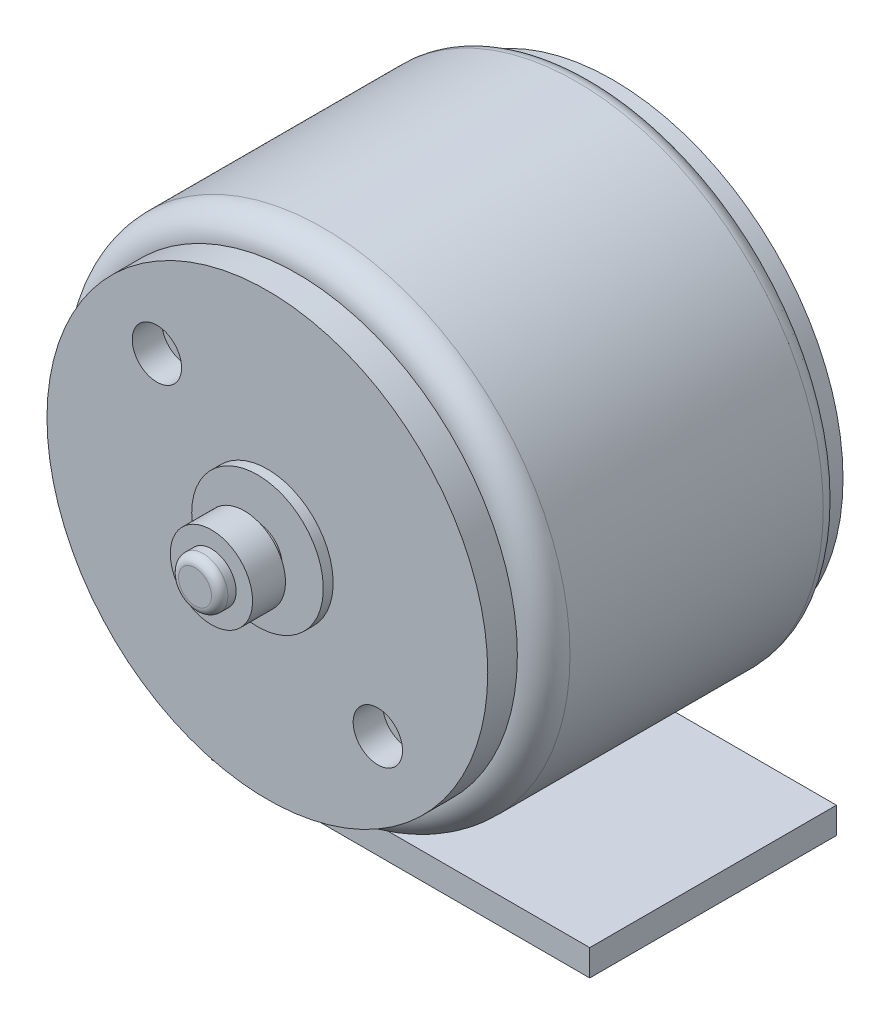
from build123d import *

# Parameters (mm, degrees)
SKETCH_4_W                = 11.5
SKETCH_4_H                = 7.5
EXTRUDE_1960_DEPTH        = 0.8
SKETCH_2004_R             = 0.75
EXTRUDE_3_DEPTH           = 0.7
EXTRUDE_3_DRAFT           = 35
EXTRUDE_3_PROFILE_2_DEPTH = 0.7
EXTRUDE_3_PROFILE_2_DRAFT = 35
EXTRUDE_3_PROFILE_3_DEPTH = 0.7
EXTRUDE_3_PROFILE_3_DRAFT = 35
EXTRUDE_3_PROFILE_4_DEPTH = 0.7
EXTRUDE_3_PROFILE_4_DRAFT = 35
EXTRUDE_3_PROFILE_5_DEPTH = 0.7
EXTRUDE_3_PROFILE_5_DRAFT = 35
EXTRUDE_3_PROFILE_6_DEPTH = 0.7
EXTRUDE_3_PROFILE_6_DRAFT = 35
EXTRUDE_3_PROFILE_7_DEPTH = 0.7
EXTRUDE_3_PROFILE_7_DRAFT = 35
EXTRUDE_3_PROFILE_8_DEPTH = 0.7
EXTRUDE_3_PROFILE_8_DRAFT = 35
EXTRUDE_4_DEPTH           = 0.01
SKETCH_7_R                = 0.75
CUT_EXTRUDE_1_DEPTH       = 0.9


with BuildPart() as part:
    # Эскиз1 → Motor (revolve)
    with BuildSketch(Plane(origin=(0, 0, 0), x_dir=(1, 0, 0), z_dir=(0, 1, 0))):
        with BuildLine():
            Line((0, 0), (-0.5, 0))
            ThreePointArc((-0.5, 0), (-0.676776695, -0.073223305), (-0.75, -0.25))
            Line((-0.75, -0.25), (-0.75, -0.5))
            Line((-0.75, -0.5), (-3, -0.5))
            Line((-3, -0.5), (-3, -1.5))
            Line((-3, -1.5), (-7, -1.5))
            Line((-7, -1.5), (-7, -2.1))
            ThreePointArc((-7, -2.1), (-7.353553391, -2.246446609), (-7.5, -2.6))
            Line((-7.5, -2.6), (-7.5, -10.3))
            ThreePointArc((-7.5, -10.3), (-7.265685425, -10.865685425), (-6.7, -11.1))
            Line((-6.7, -11.1), (-6.7, -12))
            Line((-6.7, -12), (-2, -12))
            Line((-2, -12), (-2, -12.3))
            Line((-2, -12.3), (-0.75, -12.3))
            Line((-0.75, -12.3), (-0.75, -12.7))
            Line((-0.75, -12.7), (-1.25, -12.7))
            Line((-1.25, -12.7), (-1.25, -13.7))
            Line((-1.25, -13.7), (-0.75, -13.7))
            Line((-0.75, -13.7), (-0.75, -13.95))
            ThreePointArc((-0.75, -13.95), (-0.676776695, -14.126776695), (-0.5, -14.2))
            Line((-0.5, -14.2), (0, -14.2))
            Line((0, -14.2), (0, -12))
            Line((0, -12), (0, 0))
        make_face()
    revolve(axis=Axis((0, 0, 0), (0, 0, 1)))

    # Эскиз7 → Вырез-Вытянуть1 (cut)
    with BuildSketch(Plane.XY.offset(12)):
        with Locations((3.358757211, -3.358757211)):
            Circle(SKETCH_7_R)
        with Locations((-3.358757211, 3.358757211)):
            Circle(SKETCH_7_R)
    extrude(amount=-CUT_EXTRUDE_1_DEPTH, mode=Mode.SUBTRACT)


with BuildPart() as body_2:
    # Эскиз4 → Extrude 1960 (new body)
    with BuildSketch(Plane(origin=(0, -7.5, 0), x_dir=(-1, 0, 0), z_dir=(0, -1, 0))):
        with Locations((-2.25, -6.45)):
            Rectangle(SKETCH_4_W, SKETCH_4_H)
    extrude(amount=EXTRUDE_1960_DEPTH)


with BuildPart() as extrude_3_tool:
    # Sketch 2004 → Бобышка-Вытянуть3 (with draft: the straight prism first)
    with BuildSketch(Plane.XZ.offset(8.3)):
        with Locations((-2.25, 5.7)):
            Circle(SKETCH_2004_R)
    extrude(amount=EXTRUDE_3_DEPTH)
    # Бобышка-Вытянуть3: the draft: its side faces are tilted about the plane it starts from
    extrude_3_sides = [extrude_3_tool.faces().sort_by_distance(p)[0] for p in [
        (-3, -8.65, 5.7),
    ]]
    draft(extrude_3_sides, Plane.XZ.offset(8.3), EXTRUDE_3_DRAFT)


with BuildPart() as body_2_1:
    add(body_2.part)

    # Бобышка-Вытянуть3: add extrude_3_tool
    add(extrude_3_tool.part)


with BuildPart() as extrude_3_profile_2_tool:
    # Sketch 2004 → Бобышка-Вытянуть3 profile 2 (with draft: the straight prism first)
    with BuildSketch(Plane.XZ.offset(8.3)):
        with Locations((-0.75, 7.2)):
            Circle(SKETCH_2004_R)
    extrude(amount=EXTRUDE_3_PROFILE_2_DEPTH)
    # Бобышка-Вытянуть3 profile 2: the draft: its side faces are tilted about the plane it starts from
    extrude_3_profile_2_sides = [extrude_3_profile_2_tool.faces().sort_by_distance(p)[0] for p in [
        (-1.5, -8.65, 7.2),
    ]]
    draft(extrude_3_profile_2_sides, Plane.XZ.offset(8.3), EXTRUDE_3_PROFILE_2_DRAFT)


with BuildPart() as body_2_2:
    add(body_2_1.part)

    # Бобышка-Вытянуть3 profile 2: add extrude_3_profile_2_tool
    add(extrude_3_profile_2_tool.part)


with BuildPart() as extrude_3_profile_3_tool:
    # Sketch 2004 → Бобышка-Вытянуть3 profile 3 (with draft: the straight prism first)
    with BuildSketch(Plane.XZ.offset(8.3)):
        with Locations((0.75, 5.7)):
            Circle(SKETCH_2004_R)
    extrude(amount=EXTRUDE_3_PROFILE_3_DEPTH)
    # Бобышка-Вытянуть3 profile 3: the draft: its side faces are tilted about the plane it starts from
    extrude_3_profile_3_sides = [extrude_3_profile_3_tool.faces().sort_by_distance(p)[0] for p in [
        (0, -8.65, 5.7),
    ]]
    draft(extrude_3_profile_3_sides, Plane.XZ.offset(8.3), EXTRUDE_3_PROFILE_3_DRAFT)


with BuildPart() as body_2_3:
    add(body_2_2.part)

    # Бобышка-Вытянуть3 profile 3: add extrude_3_profile_3_tool
    add(extrude_3_profile_3_tool.part)


with BuildPart() as extrude_3_profile_4_tool:
    # Sketch 2004 → Бобышка-Вытянуть3 profile 4 (with draft: the straight prism first)
    with BuildSketch(Plane.XZ.offset(8.3)):
        with Locations((2.25, 7.2)):
            Circle(SKETCH_2004_R)
    extrude(amount=EXTRUDE_3_PROFILE_4_DEPTH)
    # Бобышка-Вытянуть3 profile 4: the draft: its side faces are tilted about the plane it starts from
    extrude_3_profile_4_sides = [extrude_3_profile_4_tool.faces().sort_by_distance(p)[0] for p in [
        (1.5, -8.65, 7.2),
    ]]
    draft(extrude_3_profile_4_sides, Plane.XZ.offset(8.3), EXTRUDE_3_PROFILE_4_DRAFT)


with BuildPart() as body_2_4:
    add(body_2_3.part)

    # Бобышка-Вытянуть3 profile 4: add extrude_3_profile_4_tool
    add(extrude_3_profile_4_tool.part)


with BuildPart() as extrude_3_profile_5_tool:
    # Sketch 2004 → Бобышка-Вытянуть3 profile 5 (with draft: the straight prism first)
    with BuildSketch(Plane.XZ.offset(8.3)):
        with Locations((7, 3.7)):
            Circle(SKETCH_2004_R)
    extrude(amount=EXTRUDE_3_PROFILE_5_DEPTH)
    # Бобышка-Вытянуть3 profile 5: the draft: its side faces are tilted about the plane it starts from
    extrude_3_profile_5_sides = [extrude_3_profile_5_tool.faces().sort_by_distance(p)[0] for p in [
        (6.25, -8.65, 3.7),
    ]]
    draft(extrude_3_profile_5_sides, Plane.XZ.offset(8.3), EXTRUDE_3_PROFILE_5_DRAFT)


with BuildPart() as body_2_5:
    add(body_2_4.part)

    # Бобышка-Вытянуть3 profile 5: add extrude_3_profile_5_tool
    add(extrude_3_profile_5_tool.part)


with BuildPart() as extrude_3_profile_6_tool:
    # Sketch 2004 → Бобышка-Вытянуть3 profile 6 (with draft: the straight prism first)
    with BuildSketch(Plane.XZ.offset(8.3)):
        with Locations((7, 5.533333333)):
            Circle(SKETCH_2004_R)
    extrude(amount=EXTRUDE_3_PROFILE_6_DEPTH)
    # Бобышка-Вытянуть3 profile 6: the draft: its side faces are tilted about the plane it starts from
    extrude_3_profile_6_sides = [extrude_3_profile_6_tool.faces().sort_by_distance(p)[0] for p in [
        (6.25, -8.65, 5.533333333),
    ]]
    draft(extrude_3_profile_6_sides, Plane.XZ.offset(8.3), EXTRUDE_3_PROFILE_6_DRAFT)


with BuildPart() as body_2_6:
    add(body_2_5.part)

    # Бобышка-Вытянуть3 profile 6: add extrude_3_profile_6_tool
    add(extrude_3_profile_6_tool.part)


with BuildPart() as extrude_3_profile_7_tool:
    # Sketch 2004 → Бобышка-Вытянуть3 profile 7 (with draft: the straight prism first)
    with BuildSketch(Plane.XZ.offset(8.3)):
        with Locations((7, 7.366666667)):
            Circle(SKETCH_2004_R)
    extrude(amount=EXTRUDE_3_PROFILE_7_DEPTH)
    # Бобышка-Вытянуть3 profile 7: the draft: its side faces are tilted about the plane it starts from
    extrude_3_profile_7_sides = [extrude_3_profile_7_tool.faces().sort_by_distance(p)[0] for p in [
        (6.25, -8.65, 7.366666667),
    ]]
    draft(extrude_3_profile_7_sides, Plane.XZ.offset(8.3), EXTRUDE_3_PROFILE_7_DRAFT)


with BuildPart() as body_2_7:
    add(body_2_6.part)

    # Бобышка-Вытянуть3 profile 7: add extrude_3_profile_7_tool
    add(extrude_3_profile_7_tool.part)


with BuildPart() as extrude_3_profile_8_tool:
    # Sketch 2004 → Бобышка-Вытянуть3 profile 8 (with draft: the straight prism first)
    with BuildSketch(Plane.XZ.offset(8.3)):
        with Locations((7, 9.2)):
            Circle(SKETCH_2004_R)
    extrude(amount=EXTRUDE_3_PROFILE_8_DEPTH)
    # Бобышка-Вытянуть3 profile 8: the draft: its side faces are tilted about the plane it starts from
    extrude_3_profile_8_sides = [extrude_3_profile_8_tool.faces().sort_by_distance(p)[0] for p in [
        (6.25, -8.65, 9.2),
    ]]
    draft(extrude_3_profile_8_sides, Plane.XZ.offset(8.3), EXTRUDE_3_PROFILE_8_DRAFT)


with BuildPart() as body_2_8:
    add(body_2_7.part)

    # Бобышка-Вытянуть3 profile 8: add extrude_3_profile_8_tool
    add(extrude_3_profile_8_tool.part)

    # Эскиз6 → Бобышка-Вытянуть4 (add)
    # profile 1 of 16: a face of its own
    with BuildSketch(Plane.XZ.offset(8.3)):
        with BuildLine():
            Line((5.183226347, 9.305128205), (5.183226347, 9.228846154))
            add(Edge.make_bspline(
                [(5.183226347, 9.228846154), (5.173106274, 9.22934332), (5.153230721, 9.23031974), (5.124252058, 9.234892324), (5.096553035, 9.241435109), (5.070356056, 9.250685891), (5.045429488, 9.262174558), (5.021872342, 9.27595185), (4.999774482, 9.292270357), (4.979340763, 9.310777707), (4.96059521, 9.330878662), (4.944407508, 9.352567247), (4.930730359, 9.375358182), (4.919296343, 9.399182322), (4.910713809, 9.424308459), (4.904345697, 9.450508582), (4.900514298, 9.4778978), (4.900102465, 9.496558949), (4.899893013, 9.506049679)],
                knots=[0, 0, 0, 0, 1.10065271, 2.161652631, 3.183658789, 4.190468796, 5.17591951, 6.163126047, 7.15150782, 8.156236427, 9.156009102, 10.134482811, 11.092018607, 12.041330605, 13.001268258, 13.972401359, 14.968799086, 16, 16, 16, 16], degree=3))
            add(Edge.make_bspline(
                [(4.899893013, 9.506049679), (4.900109439, 9.515370725), (4.900534708, 9.533686246), (4.904241722, 9.560406313), (4.909922389, 9.585903666), (4.918340243, 9.609889343), (4.928902809, 9.632609504), (4.942038744, 9.653782836), (4.957126498, 9.673921332), (4.974923245, 9.69203663), (4.993912419, 9.708677717), (5.014192696, 9.723021328), (5.035163128, 9.735374158), (5.056987523, 9.745484564), (5.079736952, 9.753148701), (5.10319331, 9.758827092), (5.127627297, 9.762073168), (5.144167936, 9.762568621), (5.152577308, 9.762820513)],
                knots=[0, 0, 0, 0, 1.111674182, 2.184400057, 3.212814286, 4.223731311, 5.211378316, 6.196328225, 7.191884489, 8.207283132, 9.220262353, 10.201199469, 11.166417575, 12.120932471, 13.06540007, 14.026332106, 14.996573967, 16, 16, 16, 16], degree=3))
            add(Edge.make_bspline(
                [(5.152577308, 9.762820513), (5.164416063, 9.762409285), (5.187885819, 9.761594047), (5.222375218, 9.75462065), (5.255790478, 9.743728994), (5.282684739, 9.730616512), (5.304353679, 9.717384889), (5.322203622, 9.705473201), (5.341418154, 9.691449296), (5.362075046, 9.675432988), (5.383903778, 9.657148454), (5.407349714, 9.637070722), (5.431979324, 9.614681279), (5.448812639, 9.598980897), (5.457535241, 9.590845353)],
                knots=[0, 0, 0, 0, 1.184416499, 2.348048165, 3.509039915, 4.696071444, 5.333504901, 6.05069495, 6.844171097, 7.714965912, 8.667477798, 9.695072654, 10.805644396, 12, 12, 12, 12], degree=3))
            Line((5.457535241, 9.590845353), (5.684508398, 9.37817508))
            Line((5.684508398, 9.37817508), (5.684508398, 9.773717949))
            Line((5.684508398, 9.773717949), (5.771687885, 9.773717949))
            Line((5.771687885, 9.773717949), (5.771687885, 9.196153846))
            Line((5.771687885, 9.196153846), (5.419905033, 9.525801282))
            add(Edge.make_bspline(
                [(5.419905033, 9.525801282), (5.411526873, 9.533827197), (5.395434141, 9.549243338), (5.371939423, 9.571047678), (5.350143106, 9.590631433), (5.330086372, 9.608121371), (5.311475849, 9.623138079), (5.294914278, 9.636464193), (5.279673911, 9.647141551), (5.262008334, 9.658729575), (5.240439628, 9.669952971), (5.214081446, 9.6795974), (5.186947685, 9.685478149), (5.168611476, 9.686183609), (5.159388206, 9.686538462)],
                knots=[0, 0, 0, 0, 1.329631726, 2.553950428, 3.673215718, 4.687767853, 5.603093632, 6.413772471, 7.123043292, 7.734684054, 8.834405432, 9.900288307, 10.943827018, 12, 12, 12, 12], degree=3))
            add(Edge.make_bspline(
                [(5.159388206, 9.686538462), (5.153588438, 9.686384067), (5.142158208, 9.686079785), (5.125399667, 9.683394344), (5.109233926, 9.679336078), (5.093611262, 9.673520801), (5.078688746, 9.665844879), (5.064448215, 9.656501344), (5.050680895, 9.6457209), (5.037772237, 9.633249877), (5.025949658, 9.619549937), (5.015476666, 9.605077047), (5.006724311, 9.589764879), (4.999549462, 9.573677992), (4.993921155, 9.556861236), (4.990021214, 9.539282083), (4.987572611, 9.520989108), (4.987241312, 9.508498116), (4.987072501, 9.502133413)],
                knots=[0, 0, 0, 0, 0.991446411, 1.95395049, 2.89581595, 3.838931463, 4.798493298, 5.75982156, 6.748411868, 7.785213223, 8.824556874, 9.840280684, 10.836137867, 11.835679398, 12.848801643, 13.863922112, 14.911575587, 16, 16, 16, 16], degree=3))
            add(Edge.make_bspline(
                [(4.987072501, 9.502133413), (4.987239299, 9.495484543), (4.987566864, 9.482427259), (4.990048006, 9.463296967), (4.993809418, 9.444921487), (4.999783361, 9.427574998), (5.006841872, 9.410881872), (5.015808949, 9.395198482), (5.026228891, 9.380264435), (5.03831124, 9.366325367), (5.051886632, 9.353594562), (5.066847651, 9.342251598), (5.08308659, 9.332405907), (5.1005368, 9.323803635), (5.119372022, 9.316820921), (5.139521114, 9.311484355), (5.160897794, 9.307261899), (5.175659878, 9.305851249), (5.183226347, 9.305128205)],
                knots=[0, 0, 0, 0, 1.030878251, 2.024474673, 2.987898669, 3.934362936, 4.864849709, 5.795128259, 6.730474222, 7.685293701, 8.650606017, 9.611896181, 10.591709709, 11.591680886, 12.625074257, 13.701333388, 14.821793024, 16, 16, 16, 16], degree=3))
        make_face()
    # profile 2 of 16: a face of its own
    with BuildSketch(Plane.XZ.offset(8.3)):
        Polygon((4.921687885, 8.749358974), (5.771687885, 9.141666667), (5.771687885, 9.05874399), (5.499251988, 8.933082933), (5.499251988, 8.54775641), (5.771687885, 8.418519631), (5.771687885, 8.33525641), (4.921687885, 8.738461538), align=None)
        Polygon((5.087362965, 8.743058894), (5.412072501, 8.589132612), (5.412072501, 8.892898638), align=None, mode=Mode.SUBTRACT)
    # profile 3 of 16: a face of its own
    with BuildSketch(Plane.XZ.offset(8.3)):
        Polygon((4.921687885, 7.524248798), (4.921687885, 7.681410256), (5.771687885, 7.681410256), (5.771687885, 7.605128205), (5.008867372, 7.605128205), (5.008867372, 7.474358974), align=None)
    # profile 4 of 16: a face of its own
    with BuildSketch(Plane.XZ.offset(8.3)):
        Polygon((4.921687885, 6.896794872), (5.771687885, 7.289102564), (5.771687885, 7.206179888), (5.499251988, 7.08051883), (5.499251988, 6.695192308), (5.771687885, 6.565955529), (5.771687885, 6.482692308), (4.921687885, 6.885897436), align=None)
        Polygon((5.087362965, 6.890494792), (5.412072501, 6.73656851), (5.412072501, 7.040334535), align=None, mode=Mode.SUBTRACT)
    # profile 5 of 16: a face of its own
    with BuildSketch(Plane.XZ.offset(8.3)):
        with BuildLine():
            Line((5.183226347, 5.6), (5.183226347, 5.523717949))
            add(Edge.make_bspline(
                [(5.183226347, 5.523717949), (5.173106274, 5.524215114), (5.153230721, 5.525191535), (5.124252058, 5.529764119), (5.096553035, 5.536306904), (5.070356056, 5.545557685), (5.045429488, 5.557046353), (5.021872342, 5.570823645), (4.999774482, 5.587142152), (4.979340763, 5.605649501), (4.96059521, 5.625750457), (4.944407508, 5.647439042), (4.930730359, 5.670229977), (4.919296343, 5.694054117), (4.910713809, 5.719180254), (4.904345697, 5.745380376), (4.900514298, 5.772769595), (4.900102465, 5.791430743), (4.899893013, 5.800921474)],
                knots=[0, 0, 0, 0, 1.10065271, 2.161652631, 3.183658789, 4.190468796, 5.17591951, 6.163126047, 7.15150782, 8.156236427, 9.156009102, 10.134482811, 11.092018607, 12.041330605, 13.001268258, 13.972401359, 14.968799086, 16, 16, 16, 16], degree=3))
            add(Edge.make_bspline(
                [(4.899893013, 5.800921474), (4.900109439, 5.81024252), (4.900534708, 5.828558041), (4.904241722, 5.855278108), (4.909922389, 5.880775461), (4.918340243, 5.904761137), (4.928902809, 5.927481298), (4.942038744, 5.94865463), (4.957126498, 5.968793127), (4.974923245, 5.986908425), (4.993912419, 6.003549512), (5.014192696, 6.017893123), (5.035163128, 6.030245953), (5.056987523, 6.040356359), (5.079736952, 6.048020496), (5.10319331, 6.053698887), (5.127627297, 6.056944963), (5.144167936, 6.057440416), (5.152577308, 6.057692308)],
                knots=[0, 0, 0, 0, 1.111674182, 2.184400057, 3.212814286, 4.223731311, 5.211378316, 6.196328225, 7.191884489, 8.207283132, 9.220262353, 10.201199469, 11.166417575, 12.120932471, 13.06540007, 14.026332106, 14.996573967, 16, 16, 16, 16], degree=3))
            add(Edge.make_bspline(
                [(5.152577308, 6.057692308), (5.164416063, 6.05728108), (5.187885819, 6.056465842), (5.222375218, 6.049492445), (5.255790478, 6.038600789), (5.282684739, 6.025488307), (5.304353679, 6.012256684), (5.322203622, 6.000344996), (5.341418154, 5.986321091), (5.362075046, 5.970304783), (5.383903778, 5.952020248), (5.407349714, 5.931942517), (5.431979324, 5.909553074), (5.448812639, 5.893852692), (5.457535241, 5.885717147)],
                knots=[0, 0, 0, 0, 1.184416499, 2.348048165, 3.509039915, 4.696071444, 5.333504901, 6.05069495, 6.844171097, 7.714965912, 8.667477798, 9.695072654, 10.805644396, 12, 12, 12, 12], degree=3))
            Line((5.457535241, 5.885717147), (5.684508398, 5.673046875))
            Line((5.684508398, 5.673046875), (5.684508398, 6.068589744))
            Line((5.684508398, 6.068589744), (5.771687885, 6.068589744))
            Line((5.771687885, 6.068589744), (5.771687885, 5.491025641))
            Line((5.771687885, 5.491025641), (5.419905033, 5.820673077))
            add(Edge.make_bspline(
                [(5.419905033, 5.820673077), (5.411526873, 5.828698992), (5.395434141, 5.844115133), (5.371939423, 5.865919473), (5.350143106, 5.885503228), (5.330086372, 5.902993166), (5.311475849, 5.918009874), (5.294914278, 5.931335988), (5.279673911, 5.942013346), (5.262008334, 5.95360137), (5.240439628, 5.964824766), (5.214081446, 5.974469195), (5.186947685, 5.980349944), (5.168611476, 5.981055404), (5.159388206, 5.981410256)],
                knots=[0, 0, 0, 0, 1.329631726, 2.553950428, 3.673215718, 4.687767853, 5.603093632, 6.413772471, 7.123043292, 7.734684054, 8.834405432, 9.900288307, 10.943827018, 12, 12, 12, 12], degree=3))
            add(Edge.make_bspline(
                [(5.159388206, 5.981410256), (5.153588438, 5.981255862), (5.142158208, 5.98095158), (5.125399667, 5.978266139), (5.109233926, 5.974207873), (5.093611262, 5.968392596), (5.078688746, 5.960716674), (5.064448215, 5.951373139), (5.050680895, 5.940592695), (5.037772237, 5.928121672), (5.025949658, 5.914421732), (5.015476666, 5.899948842), (5.006724311, 5.884636674), (4.999549462, 5.868549787), (4.993921155, 5.85173303), (4.990021214, 5.834153878), (4.987572611, 5.815860903), (4.987241312, 5.803369911), (4.987072501, 5.797005208)],
                knots=[0, 0, 0, 0, 0.991446411, 1.95395049, 2.89581595, 3.838931463, 4.798493298, 5.75982156, 6.748411868, 7.785213223, 8.824556874, 9.840280684, 10.836137867, 11.835679398, 12.848801643, 13.863922112, 14.911575587, 16, 16, 16, 16], degree=3))
            add(Edge.make_bspline(
                [(4.987072501, 5.797005208), (4.987239299, 5.790356338), (4.987566864, 5.777299054), (4.990048006, 5.758168762), (4.993809418, 5.739793282), (4.999783361, 5.722446793), (5.006841872, 5.705753667), (5.015808949, 5.690070277), (5.026228891, 5.67513623), (5.03831124, 5.661197162), (5.051886632, 5.648466356), (5.066847651, 5.637123393), (5.08308659, 5.627277702), (5.1005368, 5.61867543), (5.119372022, 5.611692716), (5.139521114, 5.606356149), (5.160897794, 5.602133694), (5.175659878, 5.600723044), (5.183226347, 5.6)],
                knots=[0, 0, 0, 0, 1.030878251, 2.024474673, 2.987898669, 3.934362936, 4.864849709, 5.795128259, 6.730474222, 7.685293701, 8.650606017, 9.611896181, 10.591709709, 11.591680886, 12.625074257, 13.701333388, 14.821793024, 16, 16, 16, 16], degree=3))
        make_face()
    # profile 6 of 16: a face of its own
    with BuildSketch(Plane.XZ.offset(8.3)):
        with BuildLine():
            Line((4.921687885, 4.891666667), (4.921687885, 5.057512019))
            add(Edge.make_bspline(
                [(4.921687885, 5.057512019), (4.921729896, 5.065630492), (4.921811322, 5.081366113), (4.9231035, 5.104246237), (4.924821328, 5.125684119), (4.927702893, 5.145641874), (4.930690696, 5.164249365), (4.935076075, 5.181317687), (4.939919886, 5.196989808), (4.947372746, 5.215808817), (4.958947132, 5.237161562), (4.976113047, 5.260111768), (4.996693592, 5.280061486), (5.020146747, 5.297024661), (5.045947875, 5.310637969), (5.073541857, 5.320362002), (5.102464456, 5.326609091), (5.122293572, 5.327243488), (5.132314888, 5.327564103)],
                knots=[0, 0, 0, 0, 1.00128172, 1.940733171, 2.826250472, 3.653024905, 4.427672124, 5.149348099, 5.824709082, 6.450061444, 7.643590664, 8.808605388, 9.972104426, 11.165284501, 12.367876273, 13.557044126, 14.765369432, 16, 16, 16, 16], degree=3))
            add(Edge.make_bspline(
                [(5.132314888, 5.327564103), (5.141701525, 5.327297054), (5.160147151, 5.326772279), (5.187079484, 5.321815329), (5.212690558, 5.313947941), (5.236958454, 5.303074894), (5.259431423, 5.28906558), (5.28003985, 5.272280453), (5.29800485, 5.252113258), (5.308044519, 5.23699586), (5.313144215, 5.229316907)],
                knots=[0, 0, 0, 0, 1.044641374, 2.052818814, 3.038628718, 4.023282556, 5.005660861, 5.98021751, 6.974042014, 8, 8, 8, 8], degree=3))
            add(Edge.make_bspline(
                [(5.313144215, 5.229316907), (5.31685263, 5.238972078), (5.323947745, 5.257444813), (5.336472213, 5.282880656), (5.350143866, 5.304715331), (5.364843335, 5.323375369), (5.380921481, 5.33925023), (5.39850893, 5.352998779), (5.417591286, 5.364884666), (5.438098413, 5.374999475), (5.459856464, 5.382944783), (5.482599686, 5.388784474), (5.506240892, 5.392238779), (5.522284288, 5.392709999), (5.530411844, 5.392948718)],
                knots=[0, 0, 0, 0, 1.272586185, 2.434772614, 3.483318042, 4.437947805, 5.351807173, 6.25737843, 7.180033415, 8.1141739, 9.066731021, 10.025721652, 10.999834114, 12, 12, 12, 12], degree=3))
            add(Edge.make_bspline(
                [(5.530411844, 5.392948718), (5.538709546, 5.392711536), (5.555035509, 5.392244873), (5.579018416, 5.388800425), (5.601939819, 5.382972364), (5.623937413, 5.374930785), (5.644965078, 5.36450756), (5.664946637, 5.351639506), (5.683923663, 5.336507263), (5.701929646, 5.319405383), (5.718405686, 5.300346676), (5.732569525, 5.279342753), (5.744748407, 5.256969021), (5.754664019, 5.232939453), (5.762313907, 5.20731539), (5.767643775, 5.180111092), (5.771241058, 5.151371361), (5.771536416, 5.131648848), (5.771687885, 5.121534455)],
                knots=[0, 0, 0, 0, 0.978680899, 1.925582087, 2.851223405, 3.764209995, 4.683484765, 5.614004905, 6.562443559, 7.542772147, 8.539900013, 9.527881485, 10.525548727, 11.540192123, 12.58875426, 13.674701727, 14.807505862, 16, 16, 16, 16], degree=3))
            Line((5.771687885, 5.121534455), (5.771687885, 4.891666667))
            Line((5.771687885, 4.891666667), (4.921687885, 4.891666667))
        make_face()
        with BuildLine():
            Line((5.008867372, 4.967948718), (5.28130327, 4.967948718))
            Line((5.28130327, 4.967948718), (5.28130327, 5.019200721))
            add(Edge.make_bspline(
                [(5.28130327, 5.019200721), (5.281206146, 5.026692571), (5.281018482, 5.041168353), (5.280480913, 5.062131756), (5.278975675, 5.08159069), (5.277470866, 5.099511561), (5.275024188, 5.115866163), (5.272111792, 5.130618217), (5.269031732, 5.14399939), (5.263793117, 5.159430062), (5.256053503, 5.176935943), (5.244030592, 5.195585728), (5.22972181, 5.212103369), (5.213057021, 5.225884323), (5.194906136, 5.237262557), (5.175428501, 5.245233368), (5.155016081, 5.250547271), (5.140975869, 5.251034615), (5.13384734, 5.251282051)],
                knots=[0, 0, 0, 0, 1.156917035, 2.235399477, 3.236897345, 4.169954739, 5.01148057, 5.788325709, 6.491867502, 7.129259015, 8.302032419, 9.437271567, 10.542795419, 11.662606952, 12.764338259, 13.836858145, 14.901724648, 16, 16, 16, 16], degree=3))
            add(Edge.make_bspline(
                [(5.13384734, 5.251282051), (5.129129035, 5.251156419), (5.119873562, 5.250909976), (5.106337387, 5.248818291), (5.093618347, 5.245429205), (5.081594372, 5.240839469), (5.070564286, 5.234569208), (5.060001043, 5.227301152), (5.05053733, 5.218327706), (5.041717527, 5.208186914), (5.033823833, 5.19658404), (5.027285131, 5.183269099), (5.021358894, 5.168586302), (5.016971877, 5.152137298), (5.013114184, 5.134262916), (5.010690369, 5.114721129), (5.009130621, 5.09363577), (5.008957079, 5.079026264), (5.008867372, 5.071474359)],
                knots=[0, 0, 0, 0, 0.911708768, 1.788416306, 2.640049961, 3.452993646, 4.268229297, 5.087074648, 5.92553149, 6.781184137, 7.681934069, 8.628939405, 9.643570426, 10.73771997, 11.914765019, 13.176320755, 14.540391495, 16, 16, 16, 16], degree=3))
            Line((5.008867372, 5.071474359), (5.008867372, 4.967948718))
        make_face(mode=Mode.SUBTRACT)
        with BuildLine():
            Line((5.368482757, 4.967948718), (5.684508398, 4.967948718))
            Line((5.684508398, 4.967948718), (5.684508398, 5.076582532))
            add(Edge.make_bspline(
                [(5.684508398, 5.076582532), (5.684405935, 5.084357744), (5.684208452, 5.099343439), (5.683745313, 5.120997247), (5.681993329, 5.141014608), (5.680377131, 5.159458668), (5.677613502, 5.176280477), (5.675005355, 5.19160943), (5.671133746, 5.20519389), (5.665812676, 5.221090852), (5.657294304, 5.23885998), (5.644849042, 5.25827844), (5.629489668, 5.275211035), (5.612021289, 5.289746088), (5.593080235, 5.301741044), (5.572914124, 5.31034856), (5.55191515, 5.315697578), (5.537594042, 5.316342987), (5.530411844, 5.316666667)],
                knots=[0, 0, 0, 0, 1.160376723, 2.23647316, 3.230273494, 4.158083346, 4.997711197, 5.773399541, 6.476071462, 7.102777513, 8.27340052, 9.405620712, 10.53304798, 11.669441455, 12.787990954, 13.865552736, 14.929550474, 16, 16, 16, 16], degree=3))
            add(Edge.make_bspline(
                [(5.530411844, 5.316666667), (5.525920507, 5.316599818), (5.51701028, 5.316467199), (5.503917848, 5.314458056), (5.491229211, 5.311551463), (5.478891494, 5.307723396), (5.467112139, 5.302371964), (5.455845971, 5.295811558), (5.444866039, 5.288302007), (5.430805284, 5.276716191), (5.414806095, 5.259618481), (5.39933539, 5.235320728), (5.386657297, 5.207845865), (5.381297542, 5.187872045), (5.378528831, 5.177554087)],
                knots=[0, 0, 0, 0, 0.723302347, 1.434937762, 2.129609326, 2.821140842, 3.513216847, 4.209993937, 4.920569932, 5.655069131, 7.14393391, 8.6716197, 10.280644748, 12, 12, 12, 12], degree=3))
            add(Edge.make_bspline(
                [(5.378528831, 5.177554087), (5.377689739, 5.173418449), (5.375870415, 5.164451534), (5.373949973, 5.149829693), (5.372239029, 5.133136696), (5.370973463, 5.114333997), (5.369665302, 5.093397807), (5.36915656, 5.070283413), (5.368549597, 5.045085208), (5.368505607, 5.027601346), (5.368482757, 5.018519631)],
                knots=[0, 0, 0, 0, 0.634451884, 1.375622551, 2.216452059, 3.157844607, 4.20941857, 5.370758133, 6.634282058, 8, 8, 8, 8], degree=3))
            Line((5.368482757, 5.018519631), (5.368482757, 4.967948718))
        make_face(mode=Mode.SUBTRACT)
    # profile 7 of 16: a face of its own
    with BuildSketch(Plane.XZ.offset(8.3)):
        Polygon((4.921687885, 4.015274439), (4.921687885, 4.172435897), (5.771687885, 4.172435897), (5.771687885, 4.096153846), (5.008867372, 4.096153846), (5.008867372, 3.965384615), align=None)
    # profile 8 of 16: a face of its own
    with BuildSketch(Plane.XZ.offset(8.3)):
        with BuildLine():
            Line((4.921687885, 3.23525641), (4.921687885, 3.401101763))
            add(Edge.make_bspline(
                [(4.921687885, 3.401101763), (4.921729896, 3.409220236), (4.921811322, 3.424955856), (4.9231035, 3.447835981), (4.924821328, 3.469273862), (4.927702893, 3.489231618), (4.930690696, 3.507839109), (4.935076075, 3.52490743), (4.939919886, 3.540579551), (4.947372746, 3.559398561), (4.958947132, 3.580751306), (4.976113047, 3.603701511), (4.996693592, 3.62365123), (5.020146747, 3.640614404), (5.045947875, 3.654227713), (5.073541857, 3.663951745), (5.102464456, 3.670198834), (5.122293572, 3.670833232), (5.132314888, 3.671153846)],
                knots=[0, 0, 0, 0, 1.00128172, 1.940733171, 2.826250472, 3.653024905, 4.427672124, 5.149348099, 5.824709082, 6.450061444, 7.643590664, 8.808605388, 9.972104426, 11.165284501, 12.367876273, 13.557044126, 14.765369432, 16, 16, 16, 16], degree=3))
            add(Edge.make_bspline(
                [(5.132314888, 3.671153846), (5.141701525, 3.670886798), (5.160147151, 3.670362023), (5.187079484, 3.665405073), (5.212690558, 3.657537685), (5.236958454, 3.646664637), (5.259431423, 3.632655324), (5.28003985, 3.615870197), (5.29800485, 3.595703001), (5.308044519, 3.580585604), (5.313144215, 3.572906651)],
                knots=[0, 0, 0, 0, 1.044641374, 2.052818814, 3.038628718, 4.023282556, 5.005660861, 5.98021751, 6.974042014, 8, 8, 8, 8], degree=3))
            add(Edge.make_bspline(
                [(5.313144215, 3.572906651), (5.31685263, 3.582561822), (5.323947745, 3.601034557), (5.336472213, 3.626470399), (5.350143866, 3.648305075), (5.364843335, 3.666965112), (5.380921481, 3.682839974), (5.39850893, 3.696588522), (5.417591286, 3.70847441), (5.438098413, 3.718589218), (5.459856464, 3.726534527), (5.482599686, 3.732374218), (5.506240892, 3.735828522), (5.522284288, 3.736299742), (5.530411844, 3.736538462)],
                knots=[0, 0, 0, 0, 1.272586185, 2.434772614, 3.483318042, 4.437947805, 5.351807173, 6.25737843, 7.180033415, 8.1141739, 9.066731021, 10.025721652, 10.999834114, 12, 12, 12, 12], degree=3))
            add(Edge.make_bspline(
                [(5.530411844, 3.736538462), (5.538709546, 3.736301279), (5.555035509, 3.735834617), (5.579018416, 3.732390169), (5.601939819, 3.726562108), (5.623937413, 3.718520529), (5.644965078, 3.708097304), (5.664946637, 3.695229249), (5.683923663, 3.680097007), (5.701929646, 3.662995127), (5.718405686, 3.643936419), (5.732569525, 3.622932497), (5.744748407, 3.600558765), (5.754664019, 3.576529196), (5.762313907, 3.550905134), (5.767643775, 3.523700836), (5.771241058, 3.494961104), (5.771536416, 3.475238592), (5.771687885, 3.465124199)],
                knots=[0, 0, 0, 0, 0.978680899, 1.925582087, 2.851223405, 3.764209995, 4.683484765, 5.614004905, 6.562443559, 7.542772147, 8.539900013, 9.527881485, 10.525548727, 11.540192123, 12.58875426, 13.674701727, 14.807505862, 16, 16, 16, 16], degree=3))
            Line((5.771687885, 3.465124199), (5.771687885, 3.23525641))
            Line((5.771687885, 3.23525641), (4.921687885, 3.23525641))
        make_face()
        with BuildLine():
            Line((5.008867372, 3.311538462), (5.28130327, 3.311538462))
            Line((5.28130327, 3.311538462), (5.28130327, 3.362790465))
            add(Edge.make_bspline(
                [(5.28130327, 3.362790465), (5.281206146, 3.370282315), (5.281018482, 3.384758097), (5.280480913, 3.4057215), (5.278975675, 3.425180434), (5.277470866, 3.443101305), (5.275024188, 3.459455906), (5.272111792, 3.474207961), (5.269031732, 3.487589134), (5.263793117, 3.503019805), (5.256053503, 3.520525687), (5.244030592, 3.539175472), (5.22972181, 3.555693113), (5.213057021, 3.569474066), (5.194906136, 3.580852301), (5.175428501, 3.588823112), (5.155016081, 3.594137014), (5.140975869, 3.594624359), (5.13384734, 3.594871795)],
                knots=[0, 0, 0, 0, 1.156917035, 2.235399477, 3.236897345, 4.169954739, 5.01148057, 5.788325709, 6.491867502, 7.129259015, 8.302032419, 9.437271567, 10.542795419, 11.662606952, 12.764338259, 13.836858145, 14.901724648, 16, 16, 16, 16], degree=3))
            add(Edge.make_bspline(
                [(5.13384734, 3.594871795), (5.129129035, 3.594746162), (5.119873562, 3.59449972), (5.106337387, 3.592408034), (5.093618347, 3.589018948), (5.081594372, 3.584429212), (5.070564286, 3.578158952), (5.060001043, 3.570890896), (5.05053733, 3.561917449), (5.041717527, 3.551776658), (5.033823833, 3.540173783), (5.027285131, 3.526858842), (5.021358894, 3.512176046), (5.016971877, 3.495727042), (5.013114184, 3.477852659), (5.010690369, 3.458310873), (5.009130621, 3.437225513), (5.008957079, 3.422616008), (5.008867372, 3.415064103)],
                knots=[0, 0, 0, 0, 0.911708768, 1.788416306, 2.640049961, 3.452993646, 4.268229297, 5.087074648, 5.92553149, 6.781184137, 7.681934069, 8.628939405, 9.643570426, 10.73771997, 11.914765019, 13.176320755, 14.540391495, 16, 16, 16, 16], degree=3))
            Line((5.008867372, 3.415064103), (5.008867372, 3.311538462))
        make_face(mode=Mode.SUBTRACT)
        with BuildLine():
            Line((5.368482757, 3.311538462), (5.684508398, 3.311538462))
            Line((5.684508398, 3.311538462), (5.684508398, 3.420172276))
            add(Edge.make_bspline(
                [(5.684508398, 3.420172276), (5.684405935, 3.427947487), (5.684208452, 3.442933183), (5.683745313, 3.464586991), (5.681993329, 3.484604351), (5.680377131, 3.503048412), (5.677613502, 3.519870221), (5.675005355, 3.535199173), (5.671133746, 3.548783634), (5.665812676, 3.564680595), (5.657294304, 3.582449724), (5.644849042, 3.601868183), (5.629489668, 3.618800779), (5.612021289, 3.633335831), (5.593080235, 3.645330788), (5.572914124, 3.653938304), (5.55191515, 3.659287321), (5.537594042, 3.65993273), (5.530411844, 3.66025641)],
                knots=[0, 0, 0, 0, 1.160376723, 2.23647316, 3.230273494, 4.158083346, 4.997711197, 5.773399541, 6.476071462, 7.102777513, 8.27340052, 9.405620712, 10.53304798, 11.669441455, 12.787990954, 13.865552736, 14.929550474, 16, 16, 16, 16], degree=3))
            add(Edge.make_bspline(
                [(5.530411844, 3.66025641), (5.525920507, 3.660189562), (5.51701028, 3.660056943), (5.503917848, 3.6580478), (5.491229211, 3.655141206), (5.478891494, 3.651313139), (5.467112139, 3.645961708), (5.455845971, 3.639401301), (5.444866039, 3.631891751), (5.430805284, 3.620305934), (5.414806095, 3.603208225), (5.39933539, 3.578910472), (5.386657297, 3.551435609), (5.381297542, 3.531461789), (5.378528831, 3.52114383)],
                knots=[0, 0, 0, 0, 0.723302347, 1.434937762, 2.129609326, 2.821140842, 3.513216847, 4.209993937, 4.920569932, 5.655069131, 7.14393391, 8.6716197, 10.280644748, 12, 12, 12, 12], degree=3))
            add(Edge.make_bspline(
                [(5.378528831, 3.52114383), (5.377689739, 3.517008193), (5.375870415, 3.508041277), (5.373949973, 3.493419436), (5.372239029, 3.47672644), (5.370973463, 3.457923741), (5.369665302, 3.436987551), (5.36915656, 3.413873156), (5.368549597, 3.388674951), (5.368505607, 3.371191089), (5.368482757, 3.362109375)],
                knots=[0, 0, 0, 0, 0.634451884, 1.375622551, 2.216452059, 3.157844607, 4.20941857, 5.370758133, 6.634282058, 8, 8, 8, 8], degree=3))
            Line((5.368482757, 3.362109375), (5.368482757, 3.311538462))
        make_face(mode=Mode.SUBTRACT)
    # profile 9 of 16: a face of its own
    with BuildSketch(Plane.XZ.offset(8.3)):
        with BuildLine():
            Line((-3.08974359, 8.993200129), (-2.933653846, 8.993200129))
            add(Edge.make_bspline(
                [(-2.933653846, 8.993200129), (-2.926013051, 8.993159958), (-2.911203289, 8.993082095), (-2.889667416, 8.991874522), (-2.86949626, 8.990227969), (-2.850683969, 8.987615377), (-2.833239237, 8.98446297), (-2.817109491, 8.980645413), (-2.802346023, 8.976067901), (-2.784720255, 8.968788751), (-2.764624104, 8.957972027), (-2.742864471, 8.941988355), (-2.724257788, 8.922438077), (-2.708215201, 8.900384899), (-2.69546066, 8.876125294), (-2.686233392, 8.850237479), (-2.680391591, 8.823055367), (-2.679790807, 8.804394069), (-2.679487179, 8.79496295)],
                knots=[0, 0, 0, 0, 1.001505555, 1.941167018, 2.826882275, 3.653841531, 4.429895133, 5.150066043, 5.825578002, 6.45369114, 7.647487171, 8.808567382, 9.977351308, 11.170798116, 12.373658725, 13.556498008, 14.765093433, 16, 16, 16, 16], degree=3))
            add(Edge.make_bspline(
                [(-2.679487179, 8.79496295), (-2.679737058, 8.78612808), (-2.680228093, 8.768766727), (-2.684923581, 8.743373788), (-2.692274591, 8.719202081), (-2.702492933, 8.696339821), (-2.71577339, 8.675303567), (-2.731512434, 8.65592362), (-2.750501417, 8.639020522), (-2.764728443, 8.629570715), (-2.771955128, 8.624770642)],
                knots=[0, 0, 0, 0, 1.044552857, 2.05264487, 3.044412934, 4.028983338, 5.005914585, 5.980388656, 6.974128949, 8, 8, 8, 8], degree=3))
            add(Edge.make_bspline(
                [(-2.771955128, 8.624770642), (-2.76286703, 8.621281499), (-2.745479248, 8.614605905), (-2.721551017, 8.602803513), (-2.700935052, 8.58996646), (-2.683472847, 8.575947751), (-2.668538526, 8.560837166), (-2.655497854, 8.54441314), (-2.644370683, 8.526461424), (-2.6348363, 8.507169187), (-2.627396585, 8.486733423), (-2.621824949, 8.465345817), (-2.618632389, 8.443083061), (-2.618178071, 8.427932117), (-2.617948718, 8.420283462)],
                knots=[0, 0, 0, 0, 1.27268992, 2.434971085, 3.483601985, 4.442670788, 5.356604649, 6.2567628, 7.179492994, 8.113709626, 9.066344395, 10.018646069, 10.999752585, 12, 12, 12, 12], degree=3))
            add(Edge.make_bspline(
                [(-2.617948718, 8.420283462), (-2.618171997, 8.412473892), (-2.618611305, 8.397108342), (-2.621852441, 8.37453574), (-2.627340237, 8.352964324), (-2.634899356, 8.332254568), (-2.644765028, 8.312446537), (-2.65677142, 8.293517791), (-2.671087206, 8.275658515), (-2.687101576, 8.258670259), (-2.705218638, 8.243395336), (-2.724765096, 8.229791746), (-2.745987112, 8.218604075), (-2.768536139, 8.209206127), (-2.792665126, 8.202027339), (-2.818265722, 8.197005036), (-2.845315848, 8.193621027), (-2.863878077, 8.193342809), (-2.873397436, 8.193200129)],
                knots=[0, 0, 0, 0, 0.978564426, 1.925352924, 2.850884081, 3.763762016, 4.682927383, 5.618979971, 6.567305752, 7.547517671, 8.540179244, 9.531824382, 10.526200242, 11.540722885, 12.589160233, 13.674978461, 14.80764778, 16, 16, 16, 16], degree=3))
            Line((-2.873397436, 8.193200129), (-3.08974359, 8.193200129))
            Line((-3.08974359, 8.193200129), (-3.08974359, 8.993200129))
        make_face()
        with BuildLine():
            Line((-3.017948718, 8.911148847), (-3.017948718, 8.654738591))
            Line((-3.017948718, 8.654738591), (-2.969711538, 8.654738591))
            add(Edge.make_bspline(
                [(-2.969711538, 8.654738591), (-2.962660385, 8.654830002), (-2.94903612, 8.655006626), (-2.929305858, 8.655512573), (-2.910991568, 8.656929269), (-2.894124864, 8.658345557), (-2.878732305, 8.66064832), (-2.864847994, 8.663389377), (-2.852254029, 8.666288326), (-2.837730704, 8.671218495), (-2.821256887, 8.678504821), (-2.803695035, 8.689812669), (-2.78821287, 8.703281092), (-2.775139228, 8.718821884), (-2.764439463, 8.735934155), (-2.757007757, 8.75434487), (-2.751968377, 8.773595186), (-2.75151317, 8.786810787), (-2.751282051, 8.793520642)],
                knots=[0, 0, 0, 0, 1.156816544, 2.235205308, 3.236616184, 4.169592532, 5.011045266, 5.787822928, 6.49130361, 7.128639758, 8.301311294, 9.436451833, 10.541879658, 11.654887649, 12.756523258, 13.837046038, 14.901820046, 16, 16, 16, 16], degree=3))
            add(Edge.make_bspline(
                [(-2.751282051, 8.793520642), (-2.751402321, 8.797960818), (-2.751638243, 8.806670709), (-2.753570427, 8.819367704), (-2.756854444, 8.831309133), (-2.761072568, 8.842658644), (-2.766967125, 8.853061353), (-2.773907346, 8.862876941), (-2.782292646, 8.871771139), (-2.791837175, 8.880084167), (-2.802810574, 8.887454345), (-2.815206298, 8.893909377), (-2.829192053, 8.899107268), (-2.844532134, 8.903659532), (-2.861462668, 8.906856856), (-2.879788281, 8.909520488), (-2.899659073, 8.910876543), (-2.913406525, 8.911056055), (-2.920512821, 8.911148847)],
                knots=[0, 0, 0, 0, 0.91205012, 1.789085906, 2.630437955, 3.453916878, 4.269457761, 5.079663411, 5.91843418, 6.774407191, 7.675494373, 8.627863946, 9.638891023, 10.736472738, 11.911756761, 13.175263542, 14.539845004, 16, 16, 16, 16], degree=3))
            Line((-2.920512821, 8.911148847), (-3.017948718, 8.911148847))
        make_face(mode=Mode.SUBTRACT)
        with BuildLine():
            Line((-3.017948718, 8.572687309), (-3.017948718, 8.275251411))
            Line((-3.017948718, 8.275251411), (-2.915705128, 8.275251411))
            add(Edge.make_bspline(
                [(-2.915705128, 8.275251411), (-2.908386517, 8.275339125), (-2.894280857, 8.275508181), (-2.873914862, 8.27606008), (-2.855038724, 8.277315457), (-2.837738579, 8.279291651), (-2.821827618, 8.281435297), (-2.807496715, 8.284317875), (-2.794629699, 8.287620495), (-2.779709857, 8.292725448), (-2.762909055, 8.30065607), (-2.744803717, 8.312613608), (-2.728706295, 8.326858935), (-2.715036522, 8.343346001), (-2.703833553, 8.361273162), (-2.695683735, 8.380277813), (-2.690657253, 8.400045934), (-2.690048757, 8.41352404), (-2.68974359, 8.420283462)],
                knots=[0, 0, 0, 0, 1.160039823, 2.235823828, 3.228722157, 4.157150951, 4.99529583, 5.772374946, 6.472645482, 7.099169577, 8.269452708, 9.405989375, 10.527446681, 11.663510218, 12.788923519, 13.866172445, 14.929861265, 16, 16, 16, 16], degree=3))
            add(Edge.make_bspline(
                [(-2.68974359, 8.420283462), (-2.689806699, 8.424510512), (-2.6899319, 8.432896428), (-2.691820041, 8.445220043), (-2.694566068, 8.457157386), (-2.69811611, 8.468740869), (-2.703286274, 8.47976107), (-2.709322056, 8.49043594), (-2.716398948, 8.500779593), (-2.727426186, 8.513856679), (-2.743465497, 8.528923425), (-2.766255617, 8.543674854), (-2.792169285, 8.555571496), (-2.81096414, 8.560622805), (-2.820673077, 8.56323218)],
                knots=[0, 0, 0, 0, 0.723448775, 1.435228256, 2.130040452, 2.821711965, 3.505591119, 4.210454504, 4.921174351, 5.648778258, 7.137944449, 8.670945889, 10.280296675, 12, 12, 12, 12], degree=3))
            add(Edge.make_bspline(
                [(-2.820673077, 8.56323218), (-2.824565442, 8.564021914), (-2.833004891, 8.565734219), (-2.846766624, 8.567541694), (-2.86247768, 8.569151993), (-2.880174337, 8.570343115), (-2.899878987, 8.571574325), (-2.921633711, 8.572053141), (-2.945349669, 8.572624401), (-2.961805068, 8.572665803), (-2.970352564, 8.572687309)],
                knots=[0, 0, 0, 0, 0.634451884, 1.375622551, 2.216452059, 3.157844607, 4.20941857, 5.370758133, 6.634282058, 8, 8, 8, 8], degree=3))
            Line((-2.970352564, 8.572687309), (-3.017948718, 8.572687309))
        make_face(mode=Mode.SUBTRACT)
    # profile 10 of 16: a face of its own
    with BuildSketch(Plane.XZ.offset(8.3)):
        Polygon((-2.355608974, 8.993200129), (-2.207692308, 8.993200129), (-2.207692308, 8.193200129), (-2.279487179, 8.193200129), (-2.279487179, 8.911148847), (-2.402564103, 8.911148847), align=None)
    # profile 11 of 16: a face of its own
    with BuildSketch(Plane.XZ.offset(8.3)):
        Polygon((-1.202564103, 8.993200129), (-0.833333333, 8.193200129), (-0.911378205, 8.193200129), (-1.029647436, 8.449610386), (-1.392307692, 8.449610386), (-1.513942308, 8.193200129), (-1.592307692, 8.193200129), (-1.212820513, 8.993200129), align=None)
        Polygon((-1.20849359, 8.837270642), (-1.353365385, 8.531661668), (-1.067467949, 8.531661668), align=None, mode=Mode.SUBTRACT)
    # profile 12 of 16: a face of its own
    with BuildSketch(Plane.XZ.offset(8.3)):
        with BuildLine():
            Line((-0.658974359, 8.747046283), (-0.730769231, 8.747046283))
            add(Edge.make_bspline(
                [(-0.730769231, 8.747046283), (-0.73030131, 8.756571057), (-0.729382326, 8.775277461), (-0.725078717, 8.802551496), (-0.718920803, 8.828621165), (-0.710214184, 8.853277145), (-0.699401321, 8.876737444), (-0.686434458, 8.898908876), (-0.671075863, 8.919706862), (-0.653657181, 8.938938598), (-0.634738635, 8.956581471), (-0.614325849, 8.971816955), (-0.592875557, 8.984689566), (-0.570452837, 8.995450992), (-0.546804708, 9.003528671), (-0.522145769, 9.009522189), (-0.496367681, 9.013128211), (-0.478804247, 9.013515819), (-0.469871795, 9.01371295)],
                knots=[0, 0, 0, 0, 1.10065271, 2.161652631, 3.183658789, 4.190468796, 5.17591951, 6.163126047, 7.15150782, 8.156236427, 9.156009102, 10.134482811, 11.092018607, 12.041330605, 13.001268258, 13.972401359, 14.968799086, 16, 16, 16, 16], degree=3))
            add(Edge.make_bspline(
                [(-0.469871795, 9.01371295), (-0.461099664, 9.013507588), (-0.443862739, 9.01310406), (-0.418705707, 9.009638682), (-0.394756611, 9.004211118), (-0.372062265, 8.996596166), (-0.350803736, 8.986359725), (-0.330821326, 8.974063145), (-0.31187714, 8.959841469), (-0.294824161, 8.943097741), (-0.279165172, 8.92522291), (-0.265656085, 8.906139961), (-0.254087362, 8.88643041), (-0.244444463, 8.865943963), (-0.237345917, 8.844487728), (-0.231956613, 8.822374082), (-0.228910347, 8.799374125), (-0.228442821, 8.783806913), (-0.228205128, 8.775892437)],
                knots=[0, 0, 0, 0, 1.111607364, 2.184268762, 3.212621178, 4.221274766, 5.211760367, 6.196651075, 7.1921475, 8.207485113, 9.220403448, 10.201281604, 11.166441695, 12.114753415, 13.065576456, 14.026450734, 14.996634279, 16, 16, 16, 16], degree=3))
            add(Edge.make_bspline(
                [(-0.228205128, 8.775892437), (-0.22859216, 8.764750075), (-0.229359431, 8.742660883), (-0.235922717, 8.710200343), (-0.246173348, 8.678750419), (-0.258515601, 8.653439035), (-0.270966445, 8.633042808), (-0.282186447, 8.616249961), (-0.295321261, 8.598168711), (-0.310562061, 8.578859606), (-0.327593574, 8.558171399), (-0.346570069, 8.536116588), (-0.367626865, 8.512923041), (-0.382405951, 8.497081761), (-0.390064103, 8.488873206)],
                knots=[0, 0, 0, 0, 1.184426356, 2.348067706, 3.509069118, 4.696110526, 5.333549288, 6.050745305, 6.844228056, 7.710549037, 8.667450064, 9.695053472, 10.805634456, 12, 12, 12, 12], degree=3))
            Line((-0.390064103, 8.488873206), (-0.590224359, 8.275251411))
            Line((-0.590224359, 8.275251411), (-0.217948718, 8.275251411))
            Line((-0.217948718, 8.275251411), (-0.217948718, 8.193200129))
            Line((-0.217948718, 8.193200129), (-0.761538462, 8.193200129))
            Line((-0.761538462, 8.193200129), (-0.451282051, 8.524289873))
            add(Edge.make_bspline(
                [(-0.451282051, 8.524289873), (-0.443728249, 8.5321752), (-0.42921894, 8.5473213), (-0.408697208, 8.569433976), (-0.390265439, 8.589948157), (-0.373804321, 8.608825082), (-0.359670948, 8.626340869), (-0.347128723, 8.64192823), (-0.337079446, 8.656272105), (-0.326173069, 8.672898531), (-0.315609874, 8.693198489), (-0.306532764, 8.718006189), (-0.300997941, 8.743543847), (-0.300333979, 8.760801455), (-0.3, 8.76948218)],
                knots=[0, 0, 0, 0, 1.329631726, 2.553950428, 3.673215718, 4.687767853, 5.603093632, 6.413772471, 7.123043292, 7.734684054, 8.834405432, 9.900288307, 10.943827018, 12, 12, 12, 12], degree=3))
            add(Edge.make_bspline(
                [(-0.3, 8.76948218), (-0.300145313, 8.774940786), (-0.300431696, 8.785698649), (-0.302959169, 8.801471394), (-0.306778714, 8.816686208), (-0.312251915, 8.831389893), (-0.319476313, 8.845434613), (-0.328270229, 8.858837466), (-0.338416529, 8.871794943), (-0.350153962, 8.883944269), (-0.363048023, 8.895071401), (-0.376669566, 8.904928335), (-0.391081019, 8.913165846), (-0.406221618, 8.919918646), (-0.422049154, 8.925215876), (-0.438594238, 8.928886408), (-0.455811156, 8.931190976), (-0.467567384, 8.931502787), (-0.473557692, 8.931661668)],
                knots=[0, 0, 0, 0, 0.991446411, 1.95395049, 2.89581595, 3.838931463, 4.798493298, 5.75982156, 6.748411868, 7.785213223, 8.824556874, 9.840280684, 10.836137867, 11.835679398, 12.848801643, 13.863922112, 14.911575587, 16, 16, 16, 16], degree=3))
            add(Edge.make_bspline(
                [(-0.473557692, 8.931661668), (-0.479813883, 8.931498232), (-0.492100008, 8.93117727), (-0.510138644, 8.92893209), (-0.527346821, 8.925058755), (-0.543767828, 8.91976123), (-0.559429447, 8.913027847), (-0.574255515, 8.904641163), (-0.588212746, 8.894633507), (-0.60132738, 8.883287094), (-0.613410575, 8.870654499), (-0.624027004, 8.856572222), (-0.63330335, 8.841297384), (-0.641396889, 8.824871201), (-0.647969619, 8.807144623), (-0.652992053, 8.788180576), (-0.656966189, 8.768061403), (-0.658293851, 8.75416767), (-0.658974359, 8.747046283)],
                knots=[0, 0, 0, 0, 1.031018746, 2.02475058, 2.990194455, 3.934040569, 4.864654155, 5.795059489, 6.735614925, 7.690564532, 8.649604399, 9.611025574, 10.590972636, 11.591080095, 12.624614302, 13.701020113, 14.821632451, 16, 16, 16, 16], degree=3))
        make_face()
    # profile 13 of 16: a face of its own
    with BuildSketch(Plane.XZ.offset(8.3)):
        with BuildLine():
            Line((0.233333333, 8.993200129), (0.389423077, 8.993200129))
            add(Edge.make_bspline(
                [(0.389423077, 8.993200129), (0.397063872, 8.993159958), (0.411873634, 8.993082095), (0.433409507, 8.991874522), (0.453580663, 8.990227969), (0.472392954, 8.987615377), (0.489837686, 8.98446297), (0.505967432, 8.980645413), (0.5207309, 8.976067901), (0.538356668, 8.968788751), (0.558452819, 8.957972027), (0.580212452, 8.941988355), (0.598819135, 8.922438077), (0.614861722, 8.900384899), (0.627616264, 8.876125294), (0.636843531, 8.850237479), (0.642685332, 8.823055367), (0.643286117, 8.804394069), (0.643589744, 8.79496295)],
                knots=[0, 0, 0, 0, 1.001505555, 1.941167018, 2.826882275, 3.653841531, 4.429895133, 5.150066043, 5.825578002, 6.45369114, 7.647487171, 8.808567382, 9.977351308, 11.170798116, 12.373658725, 13.556498008, 14.765093433, 16, 16, 16, 16], degree=3))
            add(Edge.make_bspline(
                [(0.643589744, 8.79496295), (0.643339865, 8.78612808), (0.64284883, 8.768766727), (0.638153342, 8.743373788), (0.630802332, 8.719202081), (0.62058399, 8.696339821), (0.607303534, 8.675303567), (0.591564489, 8.65592362), (0.572575506, 8.639020522), (0.55834848, 8.629570715), (0.551121795, 8.624770642)],
                knots=[0, 0, 0, 0, 1.044552857, 2.05264487, 3.044412934, 4.028983338, 5.005914585, 5.980388656, 6.974128949, 8, 8, 8, 8], degree=3))
            add(Edge.make_bspline(
                [(0.551121795, 8.624770642), (0.560209893, 8.621281499), (0.577597675, 8.614605905), (0.601525906, 8.602803513), (0.622141871, 8.58996646), (0.639604076, 8.575947751), (0.654538397, 8.560837166), (0.667579069, 8.54441314), (0.67870624, 8.526461424), (0.688240623, 8.507169187), (0.695680339, 8.486733423), (0.701251974, 8.465345817), (0.704444534, 8.443083061), (0.704898852, 8.427932117), (0.705128205, 8.420283462)],
                knots=[0, 0, 0, 0, 1.27268992, 2.434971085, 3.483601985, 4.442670788, 5.356604649, 6.2567628, 7.179492994, 8.113709626, 9.066344395, 10.018646069, 10.999752585, 12, 12, 12, 12], degree=3))
            add(Edge.make_bspline(
                [(0.705128205, 8.420283462), (0.704904926, 8.412473892), (0.704465618, 8.397108342), (0.701224482, 8.37453574), (0.695736686, 8.352964324), (0.688177567, 8.332254568), (0.678311895, 8.312446537), (0.666305503, 8.293517791), (0.651989717, 8.275658515), (0.635975347, 8.258670259), (0.617858285, 8.243395336), (0.598311827, 8.229791746), (0.577089811, 8.218604075), (0.554540784, 8.209206127), (0.530411797, 8.202027339), (0.504811201, 8.197005036), (0.477761075, 8.193621027), (0.459198846, 8.193342809), (0.449679487, 8.193200129)],
                knots=[0, 0, 0, 0, 0.978564426, 1.925352924, 2.850884081, 3.763762016, 4.682927383, 5.618979971, 6.567305752, 7.547517671, 8.540179244, 9.531824382, 10.526200242, 11.540722885, 12.589160233, 13.674978461, 14.80764778, 16, 16, 16, 16], degree=3))
            Line((0.449679487, 8.193200129), (0.233333333, 8.193200129))
            Line((0.233333333, 8.193200129), (0.233333333, 8.993200129))
        make_face()
        with BuildLine():
            Line((0.305128205, 8.911148847), (0.305128205, 8.654738591))
            Line((0.305128205, 8.654738591), (0.353365385, 8.654738591))
            add(Edge.make_bspline(
                [(0.353365385, 8.654738591), (0.360416538, 8.654830002), (0.374040803, 8.655006626), (0.393771065, 8.655512573), (0.412085355, 8.656929269), (0.428952059, 8.658345557), (0.444344618, 8.66064832), (0.458228929, 8.663389377), (0.470822894, 8.666288326), (0.485346219, 8.671218495), (0.501820036, 8.678504821), (0.519381888, 8.689812669), (0.534864053, 8.703281092), (0.547937696, 8.718821884), (0.55863746, 8.735934155), (0.566069167, 8.75434487), (0.571108546, 8.773595186), (0.571563753, 8.786810787), (0.571794872, 8.793520642)],
                knots=[0, 0, 0, 0, 1.156816544, 2.235205308, 3.236616184, 4.169592532, 5.011045266, 5.787822928, 6.49130361, 7.128639758, 8.301311294, 9.436451833, 10.541879658, 11.654887649, 12.756523258, 13.837046038, 14.901820046, 16, 16, 16, 16], degree=3))
            add(Edge.make_bspline(
                [(0.571794872, 8.793520642), (0.571674602, 8.797960818), (0.57143868, 8.806670709), (0.569506496, 8.819367704), (0.566222479, 8.831309133), (0.562004355, 8.842658644), (0.556109798, 8.853061353), (0.549169578, 8.862876941), (0.540784277, 8.871771139), (0.531239748, 8.880084167), (0.520266349, 8.887454345), (0.507870625, 8.893909377), (0.49388487, 8.899107268), (0.478544789, 8.903659532), (0.461614255, 8.906856856), (0.443288643, 8.909520488), (0.42341785, 8.910876543), (0.409670398, 8.911056055), (0.402564103, 8.911148847)],
                knots=[0, 0, 0, 0, 0.91205012, 1.789085906, 2.630437955, 3.453916878, 4.269457761, 5.079663411, 5.91843418, 6.774407191, 7.675494373, 8.627863946, 9.638891023, 10.736472738, 11.911756761, 13.175263542, 14.539845004, 16, 16, 16, 16], degree=3))
            Line((0.402564103, 8.911148847), (0.305128205, 8.911148847))
        make_face(mode=Mode.SUBTRACT)
        with BuildLine():
            Line((0.305128205, 8.572687309), (0.305128205, 8.275251411))
            Line((0.305128205, 8.275251411), (0.407371795, 8.275251411))
            add(Edge.make_bspline(
                [(0.407371795, 8.275251411), (0.414690407, 8.275339125), (0.428796066, 8.275508181), (0.449162061, 8.27606008), (0.468038199, 8.277315457), (0.485338344, 8.279291651), (0.501249305, 8.281435297), (0.515580209, 8.284317875), (0.528447224, 8.287620495), (0.543367066, 8.292725448), (0.560167868, 8.30065607), (0.578273206, 8.312613608), (0.594370628, 8.326858935), (0.608040401, 8.343346001), (0.61924337, 8.361273162), (0.627393188, 8.380277813), (0.63241967, 8.400045934), (0.633028166, 8.41352404), (0.633333333, 8.420283462)],
                knots=[0, 0, 0, 0, 1.160039823, 2.235823828, 3.228722157, 4.157150951, 4.99529583, 5.772374946, 6.472645482, 7.099169577, 8.269452708, 9.405989375, 10.527446681, 11.663510218, 12.788923519, 13.866172445, 14.929861265, 16, 16, 16, 16], degree=3))
            add(Edge.make_bspline(
                [(0.633333333, 8.420283462), (0.633270224, 8.424510512), (0.633145023, 8.432896428), (0.631256882, 8.445220043), (0.628510855, 8.457157386), (0.624960813, 8.468740869), (0.619790649, 8.47976107), (0.613754867, 8.49043594), (0.606677975, 8.500779593), (0.595650737, 8.513856679), (0.579611427, 8.528923425), (0.556821306, 8.543674854), (0.530907638, 8.555571496), (0.512112783, 8.560622805), (0.502403846, 8.56323218)],
                knots=[0, 0, 0, 0, 0.723448775, 1.435228256, 2.130040452, 2.821711965, 3.505591119, 4.210454504, 4.921174351, 5.648778258, 7.137944449, 8.670945889, 10.280296675, 12, 12, 12, 12], degree=3))
            add(Edge.make_bspline(
                [(0.502403846, 8.56323218), (0.498511481, 8.564021914), (0.490072032, 8.565734219), (0.476310299, 8.567541694), (0.460599243, 8.569151993), (0.442902586, 8.570343115), (0.423197936, 8.571574325), (0.401443212, 8.572053141), (0.377727254, 8.572624401), (0.361271855, 8.572665803), (0.352724359, 8.572687309)],
                knots=[0, 0, 0, 0, 0.634451884, 1.375622551, 2.216452059, 3.157844607, 4.20941857, 5.370758133, 6.634282058, 8, 8, 8, 8], degree=3))
            Line((0.352724359, 8.572687309), (0.305128205, 8.572687309))
        make_face(mode=Mode.SUBTRACT)
    # profile 14 of 16: a face of its own
    with BuildSketch(Plane.XZ.offset(8.3)):
        with BuildLine():
            Line((0.9, 8.747046283), (0.828205128, 8.747046283))
            add(Edge.make_bspline(
                [(0.828205128, 8.747046283), (0.828673049, 8.756571057), (0.829592033, 8.775277461), (0.833895642, 8.802551496), (0.840053556, 8.828621165), (0.848760174, 8.853277145), (0.859573038, 8.876737444), (0.872539901, 8.898908876), (0.887898496, 8.919706862), (0.905317178, 8.938938598), (0.924235724, 8.956581471), (0.94464851, 8.971816955), (0.966098802, 8.984689566), (0.988521522, 8.995450992), (1.012169651, 9.003528671), (1.03682859, 9.009522189), (1.062606678, 9.013128211), (1.080170111, 9.013515819), (1.089102564, 9.01371295)],
                knots=[0, 0, 0, 0, 1.10065271, 2.161652631, 3.183658789, 4.190468796, 5.17591951, 6.163126047, 7.15150782, 8.156236427, 9.156009102, 10.134482811, 11.092018607, 12.041330605, 13.001268258, 13.972401359, 14.968799086, 16, 16, 16, 16], degree=3))
            add(Edge.make_bspline(
                [(1.089102564, 9.01371295), (1.097874695, 9.013507588), (1.11511162, 9.01310406), (1.140268652, 9.009638682), (1.164217748, 9.004211118), (1.186912094, 8.996596166), (1.208170623, 8.986359725), (1.228153033, 8.974063145), (1.247097219, 8.959841469), (1.264150198, 8.943097741), (1.279809187, 8.92522291), (1.293318274, 8.906139961), (1.304886997, 8.88643041), (1.314529896, 8.865943963), (1.321628442, 8.844487728), (1.327017746, 8.822374082), (1.330064012, 8.799374125), (1.330531538, 8.783806913), (1.330769231, 8.775892437)],
                knots=[0, 0, 0, 0, 1.111607364, 2.184268762, 3.212621178, 4.221274766, 5.211760367, 6.196651075, 7.1921475, 8.207485113, 9.220403448, 10.201281604, 11.166441695, 12.114753415, 13.065576456, 14.026450734, 14.996634279, 16, 16, 16, 16], degree=3))
            add(Edge.make_bspline(
                [(1.330769231, 8.775892437), (1.330382199, 8.764750075), (1.329614928, 8.742660883), (1.323051642, 8.710200343), (1.312801011, 8.678750419), (1.300458758, 8.653439035), (1.288007914, 8.633042808), (1.276787912, 8.616249961), (1.263653098, 8.598168711), (1.248412298, 8.578859606), (1.231380785, 8.558171399), (1.21240429, 8.536116588), (1.191347494, 8.512923041), (1.176568408, 8.497081761), (1.168910256, 8.488873206)],
                knots=[0, 0, 0, 0, 1.184426356, 2.348067706, 3.509069118, 4.696110526, 5.333549288, 6.050745305, 6.844228056, 7.710549037, 8.667450064, 9.695053472, 10.805634456, 12, 12, 12, 12], degree=3))
            Line((1.168910256, 8.488873206), (0.96875, 8.275251411))
            Line((0.96875, 8.275251411), (1.341025641, 8.275251411))
            Line((1.341025641, 8.275251411), (1.341025641, 8.193200129))
            Line((1.341025641, 8.193200129), (0.797435897, 8.193200129))
            Line((0.797435897, 8.193200129), (1.107692308, 8.524289873))
            add(Edge.make_bspline(
                [(1.107692308, 8.524289873), (1.11524611, 8.5321752), (1.129755419, 8.5473213), (1.150277151, 8.569433976), (1.16870892, 8.589948157), (1.185170038, 8.608825082), (1.199303411, 8.626340869), (1.211845635, 8.64192823), (1.221894913, 8.656272105), (1.23280129, 8.672898531), (1.243364485, 8.693198489), (1.252441595, 8.718006189), (1.257976418, 8.743543847), (1.25864038, 8.760801455), (1.258974359, 8.76948218)],
                knots=[0, 0, 0, 0, 1.329631726, 2.553950428, 3.673215718, 4.687767853, 5.603093632, 6.413772471, 7.123043292, 7.734684054, 8.834405432, 9.900288307, 10.943827018, 12, 12, 12, 12], degree=3))
            add(Edge.make_bspline(
                [(1.258974359, 8.76948218), (1.258829046, 8.774940786), (1.258542663, 8.785698649), (1.25601519, 8.801471394), (1.252195645, 8.816686208), (1.246722444, 8.831389893), (1.239498046, 8.845434613), (1.23070413, 8.858837466), (1.22055783, 8.871794943), (1.208820397, 8.883944269), (1.195926336, 8.895071401), (1.182304793, 8.904928335), (1.16789334, 8.913165846), (1.152752741, 8.919918646), (1.136925205, 8.925215876), (1.120380121, 8.928886408), (1.103163203, 8.931190976), (1.091406975, 8.931502787), (1.085416667, 8.931661668)],
                knots=[0, 0, 0, 0, 0.991446411, 1.95395049, 2.89581595, 3.838931463, 4.798493298, 5.75982156, 6.748411868, 7.785213223, 8.824556874, 9.840280684, 10.836137867, 11.835679398, 12.848801643, 13.863922112, 14.911575587, 16, 16, 16, 16], degree=3))
            add(Edge.make_bspline(
                [(1.085416667, 8.931661668), (1.079160476, 8.931498232), (1.066874351, 8.93117727), (1.048835715, 8.92893209), (1.031627538, 8.925058755), (1.015206531, 8.91976123), (0.999544912, 8.913027847), (0.984718844, 8.904641163), (0.970761613, 8.894633507), (0.957646979, 8.883287094), (0.945563783, 8.870654499), (0.934947355, 8.856572222), (0.925671009, 8.841297384), (0.91757747, 8.824871201), (0.91100474, 8.807144623), (0.905982306, 8.788180576), (0.90200817, 8.768061403), (0.900680508, 8.75416767), (0.9, 8.747046283)],
                knots=[0, 0, 0, 0, 1.031018746, 2.02475058, 2.990194455, 3.934040569, 4.864654155, 5.795059489, 6.735614925, 7.690564532, 8.649604399, 9.611025574, 10.590972636, 11.591080095, 12.624614302, 13.701020113, 14.821632451, 16, 16, 16, 16], degree=3))
        make_face()
    # profile 15 of 16: a face of its own
    with BuildSketch(Plane.XZ.offset(8.3)):
        Polygon((2.120512821, 8.993200129), (2.48974359, 8.193200129), (2.411698718, 8.193200129), (2.293429487, 8.449610386), (1.930769231, 8.449610386), (1.809134615, 8.193200129), (1.730769231, 8.193200129), (2.11025641, 8.993200129), align=None)
        Polygon((2.114583333, 8.837270642), (1.969711538, 8.531661668), (2.255608974, 8.531661668), align=None, mode=Mode.SUBTRACT)
    # profile 16 of 16: a face of its own
    with BuildSketch(Plane.XZ.offset(8.3)):
        Polygon((2.731570513, 8.993200129), (2.879487179, 8.993200129), (2.879487179, 8.193200129), (2.807692308, 8.193200129), (2.807692308, 8.911148847), (2.684615385, 8.911148847), align=None)
    extrude(amount=EXTRUDE_4_DEPTH)


solid = Compound([part.part, body_2_8.part])
